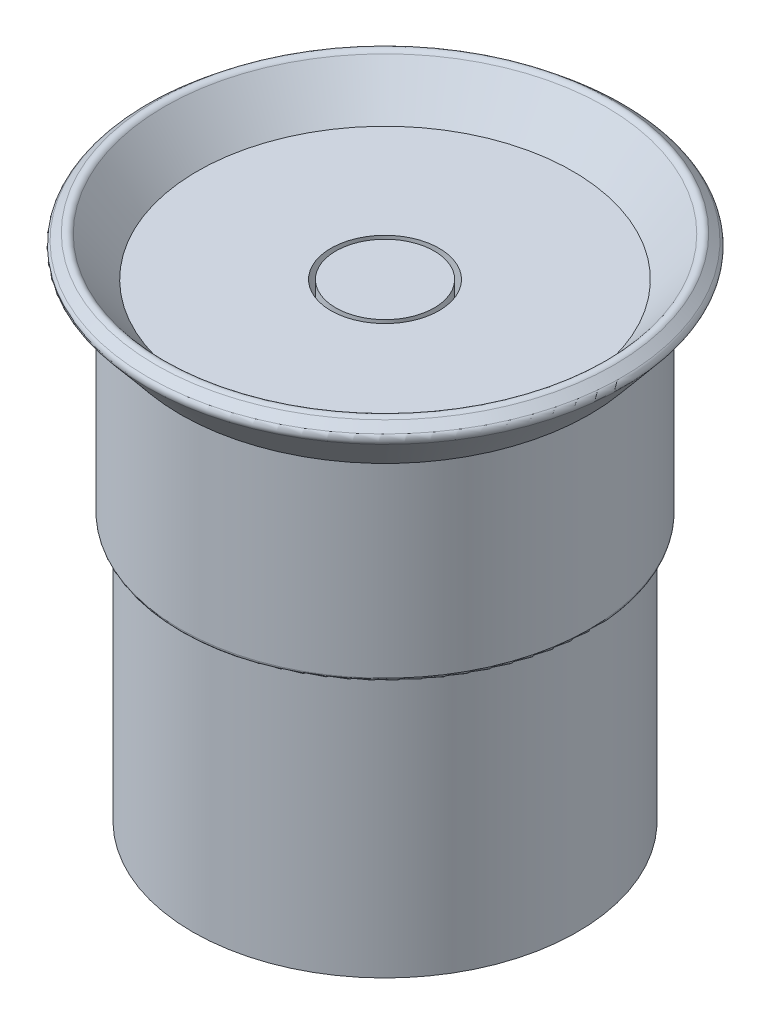
from build123d import *

# Parameters (mm, degrees)
ESBO_O1_R                = 16
ESBO_O1_R_2              = 14
RESSALTO_EXTRUS_O1_DEPTH = 22
ESBO_O2_R                = 17
RESSALTO_EXTRUS_O2_DEPTH = 17
ESBO_O3_R                = 4.5
CORTE_EXTRUS_O1_DEPTH    = 46.814844756
FILETE1_R                = 0.3
ESBO_O4_R                = 4.095378156
RESSALTO_EXTRUS_O3_DEPTH = 3
FILETE2_R                = 0.5


with BuildPart() as part:
    # Esboço1 → Ressalto-extrusão1 (new body)
    with BuildSketch(Plane(origin=(0, 0, 0), x_dir=(1, 0, 0), z_dir=(0, 1, 0))):
        with Locations(Location((0, 0, 0), (0, 0, 270))):
            Circle(ESBO_O1_R)
        with Locations(Location((0, 0, 0), (0, 0, 270))):
            Circle(ESBO_O1_R_2, mode=Mode.SUBTRACT)
    extrude(amount=RESSALTO_EXTRUS_O1_DEPTH)

    # Esboço2 → Ressalto-extrusão2 (add)
    with BuildSketch(Plane(origin=(0, 22, 0), x_dir=(1, 0, 0), z_dir=(0, 1, 0))):
        with Locations(Location((0, 0, 0), (0, 0, 270))):
            Circle(ESBO_O2_R)
    extrude(amount=RESSALTO_EXTRUS_O2_DEPTH)

    # Esboço3 → Corte-extrusão1 (cut, through all)
    with BuildSketch(Plane(origin=(0, 39, 0), x_dir=(1, 0, 0), z_dir=(0, 1, 0))):
        with Locations(Location((0, 0, 0), (0, 0, 270))):
            Circle(ESBO_O3_R)
    extrude(amount=-CORTE_EXTRUS_O1_DEPTH, mode=Mode.SUBTRACT)

    # Filete1
    filete1_edges = [part.edges().sort_by_distance(p)[0] for p in [
        (0, 39, -17),
        (0, 22, -17),
    ]]
    fillet(filete1_edges, radius=FILETE1_R)

    # Esboço5 → Revolução1 (revolve)
    with BuildSketch(Plane.XY, mode=Mode.PRIVATE) as revolu_o1_sk:
        Polygon((15.606287028, 39), (18.653476558, 42.670201729), (20.085778779, 41.481031037), (17, 37.764350306), align=None)
    revolve(revolu_o1_sk.sketch.rotate(Axis((0, 39, 0), (0, 1, 0)), 90), axis=Axis((0, 39, 0), (0, 1, 0)))

    # Filete2
    filete2_edges = [part.edges().sort_by_distance(p)[0] for p in [
        (0, 42.670201729, 18.653476558),
        (0, 41.481031037, 20.085778779),
    ]]
    fillet(filete2_edges, radius=FILETE2_R)


with BuildPart() as body_2:
    # Esboço4 → Ressalto-extrusão3 (new body)
    with BuildSketch(Plane(origin=(0, 39, 0), x_dir=(1, 0, 0), z_dir=(0, 1, 0))):
        with Locations(Location((0, 0, 0), (0, 0, 270))):
            Circle(ESBO_O4_R)
    extrude(amount=-RESSALTO_EXTRUS_O3_DEPTH)


solid = Compound([part.part, body_2.part])
